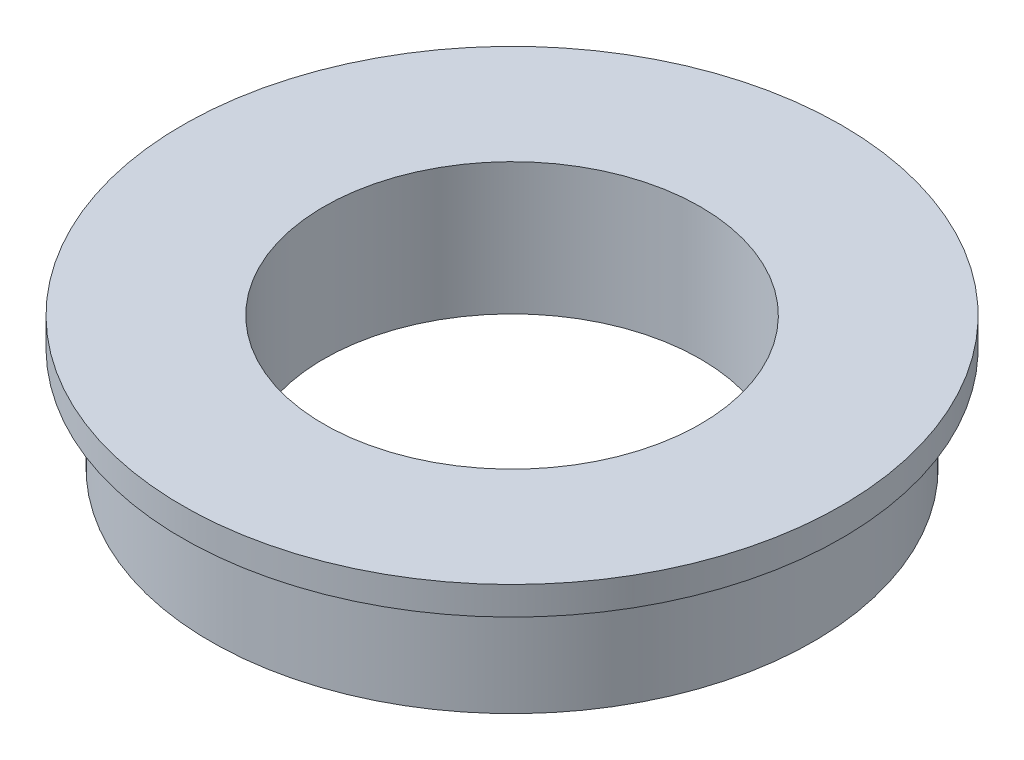
from build123d import *


with BuildPart() as part:
    # Sketch1 → Revolve1 (revolve)
    with BuildSketch(Plane.XY, mode=Mode.PRIVATE) as revolve1_sk:
        Polygon((10, 0), (17.5, 0), (17.5, -1.5), (16, -1.5), (16, -7), (10, -7), align=None)
    revolve(revolve1_sk.sketch.rotate(Axis((0, -7.378378695, 0), (0, 1, 0)), 90), axis=Axis((0, -7.378378695, 0), (0, 1, 0)))


solid = part.part
